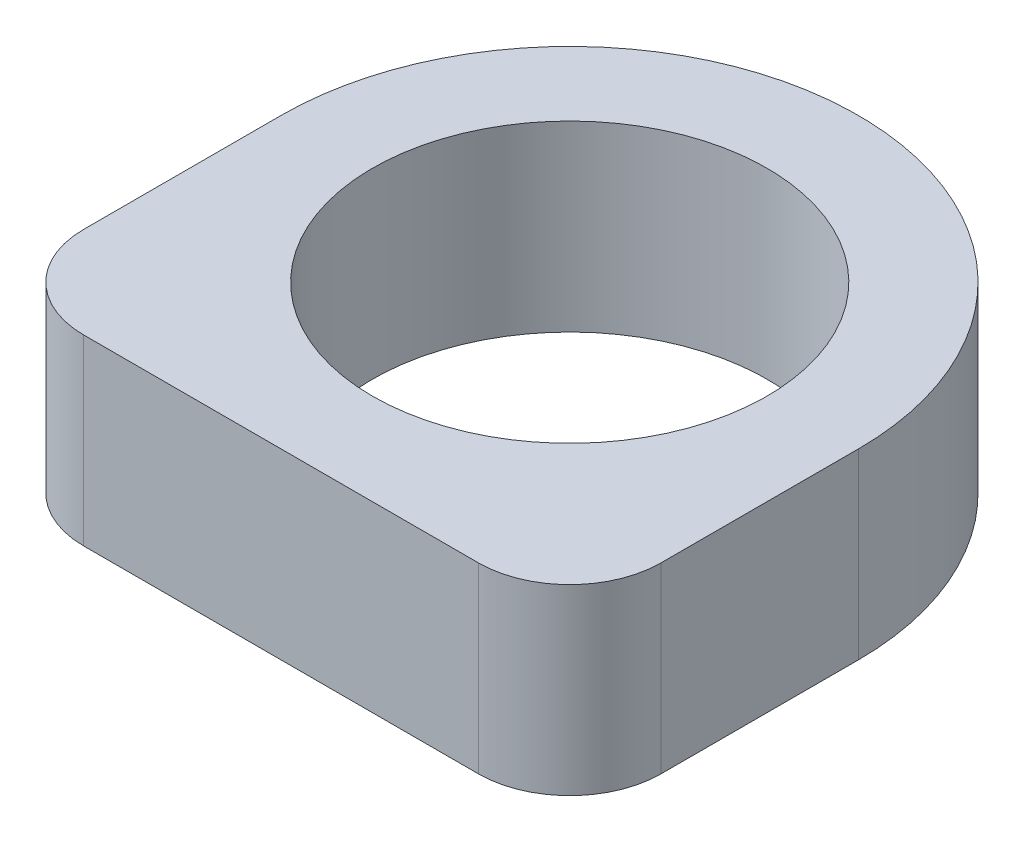
from build123d import *

# Parameters (mm, degrees)
BOSS_EXTRUDE2_DEPTH = 10
FILLET1_R           = 5


with BuildPart() as part:
    # Sketch1 → Boss-Extrude2 (new body)
    with BuildSketch(Plane(origin=(0, 0, 0), x_dir=(1, 0, 0), z_dir=(0, 1, 0))):
        with BuildLine():
            ThreePointArc((-13.512538708, 1.615980507), (-2.712538708, 12.415980507), (8.087461292, 1.615980507))
            Line((8.087461292, 1.615980507), (13.087461292, 1.615980507))
            ThreePointArc((13.087461292, 1.615980507), (-2.712538708, 17.415980507), (-18.512538708, 1.615980507))
            Line((-18.512538708, 1.615980507), (-13.512538708, 1.615980507))
        make_face()
        with BuildLine():
            Line((13.087461292, 1.615980507), (8.087461292, 1.615980507))
            ThreePointArc((8.087461292, 1.615980507), (-2.712538708, -9.184019493), (-13.512538708, 1.615980507))
            Line((-13.512538708, 1.615980507), (-18.512538708, 1.615980507))
            ThreePointArc((-18.512538708, 1.615980507), (-13.884825857, -9.55630663), (-2.712538726, -14.184019493))
            ThreePointArc((-2.712538726, -14.184019493), (8.459748429, -9.556306643), (13.087461292, 1.615980507))
        make_face()
        with BuildLine():
            Line((13.087461292, -14.184019493), (13.087461292, 1.615980507))
            ThreePointArc((13.087461292, 1.615980507), (8.459748429, -9.556306643), (-2.712538726, -14.184019493))
            Line((-2.712538726, -14.184019493), (13.087461292, -14.184019493))
        make_face()
        with BuildLine():
            ThreePointArc((-2.712538726, -14.184019493), (-13.884825857, -9.55630663), (-18.512538708, 1.615980507))
            Line((-18.512538708, 1.615980507), (-18.512538708, -14.184019493))
            Line((-18.512538708, -14.184019493), (-2.712538726, -14.184019493))
        make_face()
    extrude(amount=BOSS_EXTRUDE2_DEPTH)

    # Fillet1
    fillet1_edges = [part.edges().sort_by_distance(p)[0] for p in [
        (13.087461292, 5, 14.184019493),
        (-18.512538708, 5, 14.184019493),
    ]]
    fillet(fillet1_edges, radius=FILLET1_R)


solid = part.part
